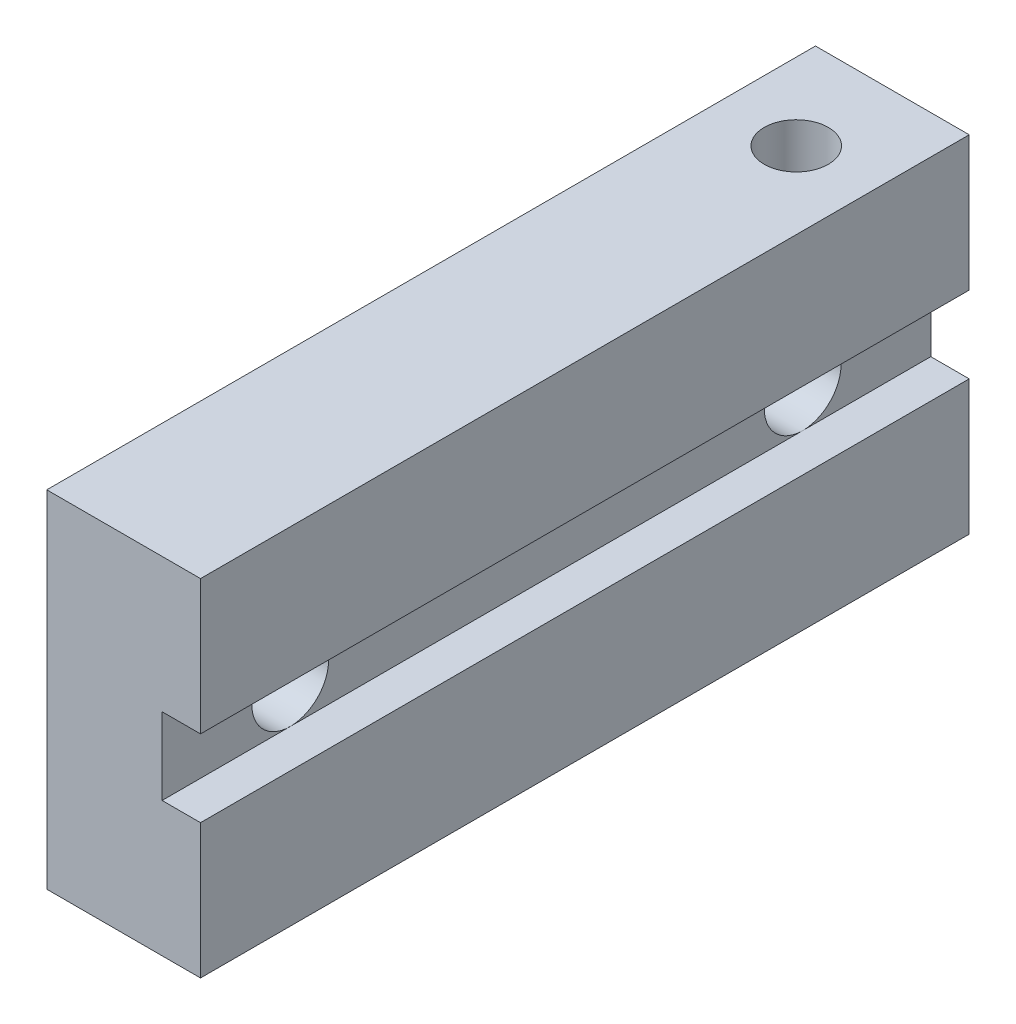
from build123d import *

# Parameters (mm, degrees)
SKETCH1_W                                = 60
SKETCH1_H                                = 10.5
BOSS_EXTRUDE1_DEPTH                      = 12
BOSS_EXTRUDE1_2_DEPTH                    = 12
SKETCH1_4_W                              = 60
SKETCH1_4_H                              = 6
BOSS_EXTRUDE2_DEPTH                      = 9
CBORE_FOR_M5_PAN_HEAD_SCREW1_D           = 6
CBORE_FOR_M5_PAN_HEAD_SCREW1_CBORE_D     = 11
CBORE_FOR_M5_PAN_HEAD_SCREW1_CBORE_DEPTH = 3.7
F_5_0_5_DIAMETER_HOLE17_D                = 5
F_5_0_5_DIAMETER_HOLE17_DEPTH            = 8.2
F_5_0_5_DIAMETER_HOLE17_TIP              = 1.502151548
F_5_0_5_DIAMETER_HOLE17_ON_FACE_2_D      = 5
F_5_0_5_DIAMETER_HOLE17_ON_FACE_2_DEPTH  = 8.2
F_5_0_5_DIAMETER_HOLE17_ON_FACE_2_TIP    = 1.502151548


with BuildPart() as part:
    # Sketch1 → Boss-Extrude1 (new body)
    with BuildSketch(Plane(origin=(0, 0, 0), x_dir=(0, 0, -1), z_dir=(1, 0, 0))):
        with Locations((0, -8.25)):
            Rectangle(SKETCH1_W, SKETCH1_H)
    extrude(amount=BOSS_EXTRUDE1_DEPTH)



with BuildPart() as body_2:
    # Sketch1 → Boss-Extrude1 2 (new body)
    with BuildSketch(Plane(origin=(0, 0, 0), x_dir=(0, 0, -1), z_dir=(1, 0, 0))):
        with Locations((0, 8.25)):
            Rectangle(SKETCH1_W, SKETCH1_H)
    extrude(amount=BOSS_EXTRUDE1_2_DEPTH)


with BuildPart() as part_1:
    add(part.part)

    add(body_2.part)  # Boss-Extrude2 merges body 2
    # Sketch1<4> → Boss-Extrude2 (add)
    with BuildSketch(Plane(origin=(0, 0, 0), x_dir=(0, 0, -1), z_dir=(1, 0, 0))):
        Rectangle(SKETCH1_4_W, SKETCH1_4_H)
    extrude(amount=BOSS_EXTRUDE2_DEPTH)

    # CBORE for M5 Pan Head Screw1 (through all)
    with Locations(Plane(origin=(0, 0, -20), x_dir=(0, 0, -1), z_dir=(-1, 0, 0))):
        with Locations((0, 0), (-40, 0)):
            CounterBoreHole(CBORE_FOR_M5_PAN_HEAD_SCREW1_D / 2, CBORE_FOR_M5_PAN_HEAD_SCREW1_CBORE_D / 2, CBORE_FOR_M5_PAN_HEAD_SCREW1_CBORE_DEPTH)

    # Ø5.0 (5) Diameter Hole17
    with Locations(Plane(origin=(6, 13.5, -22.5), x_dir=(0, 0, 1), z_dir=(0, 1, 0))):
        with Locations((0, 0)):
            Hole(F_5_0_5_DIAMETER_HOLE17_D / 2, depth=F_5_0_5_DIAMETER_HOLE17_DEPTH)
            with Locations((0, 0, -(F_5_0_5_DIAMETER_HOLE17_DEPTH + F_5_0_5_DIAMETER_HOLE17_TIP / 2))):  # 118° drill point
                Cone(0, F_5_0_5_DIAMETER_HOLE17_D / 2, F_5_0_5_DIAMETER_HOLE17_TIP, mode=Mode.SUBTRACT)

    # Ø5.0 (5) Diameter Hole17 on face 2
    with Locations(Plane(origin=(-4.960948742, 0, -17.906998739), x_dir=(0, 0, 1), z_dir=(0, 1, 0))):
        with Locations((0, 0), (0.436961169, -4.141332284)):
            Hole(F_5_0_5_DIAMETER_HOLE17_ON_FACE_2_D / 2, depth=F_5_0_5_DIAMETER_HOLE17_ON_FACE_2_DEPTH)
            with Locations((0, 0, -(F_5_0_5_DIAMETER_HOLE17_ON_FACE_2_DEPTH + F_5_0_5_DIAMETER_HOLE17_ON_FACE_2_TIP / 2))):  # 118° drill point
                Cone(0, F_5_0_5_DIAMETER_HOLE17_ON_FACE_2_D / 2, F_5_0_5_DIAMETER_HOLE17_ON_FACE_2_TIP, mode=Mode.SUBTRACT)


solid = part_1.part
